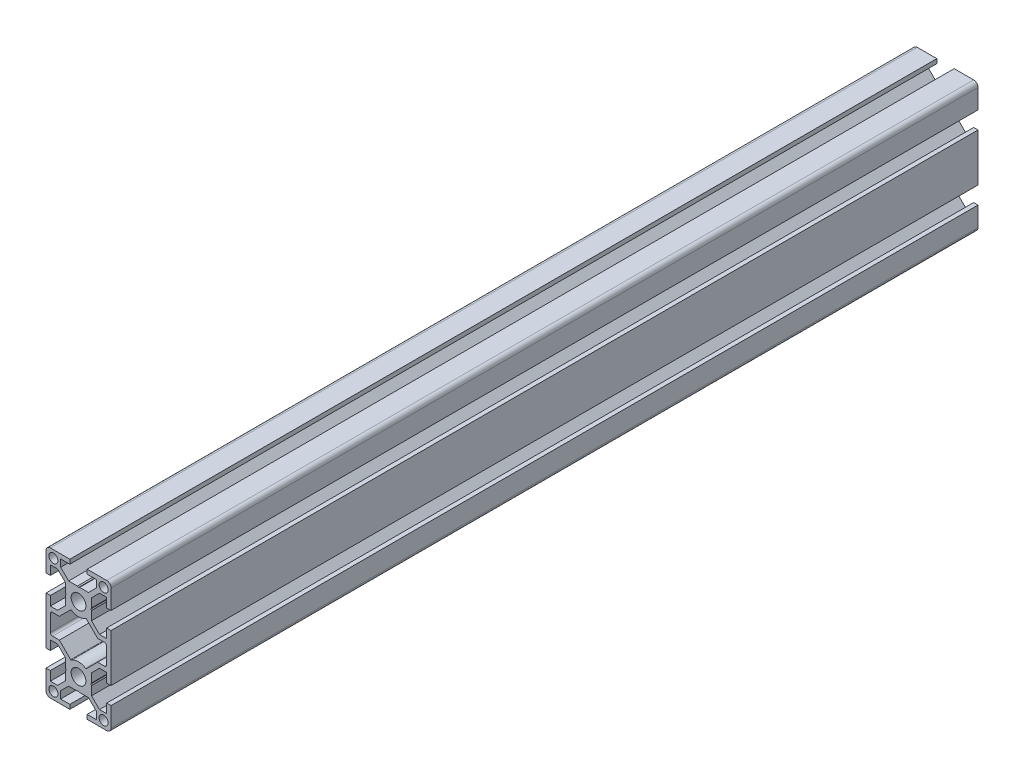
from build123d import *

# Parameters (mm, degrees)
MODEL_R             = 2.1
MODEL_R_2           = 3.4
BOSS_EXTRUDE1_DEPTH = 400


with BuildPart() as part:
    # Model → Boss-Extrude1 (new body)
    with BuildSketch(Plane.XY):
        with BuildLine():
            Line((13, -11), (15, -11))
            Line((15, -11), (15, 11))
            Line((15, 11), (13, 11))
            Line((13, 11), (13, 6.75))
            Line((13, 6.75), (9.664213562, 6.75))
            Line((9.664213562, 6.75), (6, 10.414213562))
            Line((6, 10.414213562), (6, 14.480384758))
            Line((6, 14.480384758), (5.7, 15))
            Line((5.7, 15), (6, 15.519615242))
            Line((6, 15.519615242), (6, 19.585786438))
            Line((6, 19.585786438), (9.664213562, 23.25))
            Line((9.664213562, 23.25), (13, 23.25))
            Line((13, 23.25), (13, 19))
            Line((13, 19), (15, 19))
            Line((15, 19), (15, 28))
            ThreePointArc((15, 28), (14.414213562, 29.414213562), (13, 30))
            Line((13, 30), (4, 30))
            Line((4, 30), (4, 28))
            Line((4, 28), (8.25, 28))
            Line((8.25, 28), (8.25, 24.664213562))
            Line((8.25, 24.664213562), (4.585786438, 21))
            Line((4.585786438, 21), (0.519615242, 21))
            Line((0.519615242, 21), (0, 20.7))
            Line((0, 20.7), (-0.519615242, 21))
            Line((-0.519615242, 21), (-4.585786438, 21))
            Line((-4.585786438, 21), (-8.25, 24.664213562))
            Line((-8.25, 24.664213562), (-8.25, 28))
            Line((-8.25, 28), (-4, 28))
            Line((-4, 28), (-4, 30))
            Line((-4, 30), (-13, 30))
            ThreePointArc((-13, 30), (-14.414213562, 29.414213562), (-15, 28))
            Line((-15, 28), (-15, 19))
            Line((-15, 19), (-13, 19))
            Line((-13, 19), (-13, 23.25))
            Line((-13, 23.25), (-9.664213562, 23.25))
            Line((-9.664213562, 23.25), (-6, 19.585786438))
            Line((-6, 19.585786438), (-6, 15.519615242))
            Line((-6, 15.519615242), (-5.7, 15))
            Line((-5.7, 15), (-6, 14.480384758))
            Line((-6, 14.480384758), (-6, 10.414213562))
            Line((-6, 10.414213562), (-9.664213562, 6.75))
            Line((-9.664213562, 6.75), (-13, 6.75))
            Line((-13, 6.75), (-13, 11))
            Line((-13, 11), (-15, 11))
            Line((-15, 11), (-15, -11))
            Line((-15, -11), (-13, -11))
            Line((-13, -11), (-13, -6.75))
            Line((-13, -6.75), (-9.664213562, -6.75))
            Line((-9.664213562, -6.75), (-6, -10.414213562))
            Line((-6, -10.414213562), (-6, -14.480384758))
            Line((-6, -14.480384758), (-5.7, -15))
            Line((-5.7, -15), (-6, -15.519615242))
            Line((-6, -15.519615242), (-6, -19.585786438))
            Line((-6, -19.585786438), (-9.664213562, -23.25))
            Line((-9.664213562, -23.25), (-13, -23.25))
            Line((-13, -23.25), (-13, -19))
            Line((-13, -19), (-15, -19))
            Line((-15, -19), (-15, -28))
            ThreePointArc((-15, -28), (-14.414213562, -29.414213562), (-13, -30))
            Line((-13, -30), (-4, -30))
            Line((-4, -30), (-4, -28))
            Line((-4, -28), (-8.25, -28))
            Line((-8.25, -28), (-8.25, -24.664213562))
            Line((-8.25, -24.664213562), (-4.585786438, -21))
            Line((-4.585786438, -21), (-0.519615242, -21))
            Line((-0.519615242, -21), (0, -20.7))
            Line((0, -20.7), (0.519615242, -21))
            Line((0.519615242, -21), (4.585786438, -21))
            Line((4.585786438, -21), (8.25, -24.664213562))
            Line((8.25, -24.664213562), (8.25, -28))
            Line((8.25, -28), (4, -28))
            Line((4, -28), (4, -30))
            Line((4, -30), (13, -30))
            ThreePointArc((13, -30), (14.414213562, -29.414213562), (15, -28))
            Line((15, -28), (15, -19))
            Line((15, -19), (13, -19))
            Line((13, -19), (13, -23.25))
            Line((13, -23.25), (9.664213562, -23.25))
            Line((9.664213562, -23.25), (6, -19.585786438))
            Line((6, -19.585786438), (6, -15.519615242))
            Line((6, -15.519615242), (5.7, -15))
            Line((5.7, -15), (6, -14.480384758))
            Line((6, -14.480384758), (6, -10.414213562))
            Line((6, -10.414213562), (9.664213562, -6.75))
            Line((9.664213562, -6.75), (13, -6.75))
            Line((13, -6.75), (13, -11))
        make_face()
        with Locations((11.6, -26.6)):
            Circle(MODEL_R, mode=Mode.SUBTRACT)
        with Locations((11.6, 26.6)):
            Circle(MODEL_R, mode=Mode.SUBTRACT)
        with Locations((0, 15)):
            Circle(MODEL_R_2, mode=Mode.SUBTRACT)
        with Locations((0, -15)):
            Circle(MODEL_R_2, mode=Mode.SUBTRACT)
        with Locations((-11.6, 26.6)):
            Circle(MODEL_R, mode=Mode.SUBTRACT)
        with Locations((-11.6, -26.6)):
            Circle(MODEL_R, mode=Mode.SUBTRACT)
        with BuildLine():
            Line((-8.835786438, 4.75), (-12, 4.75))
            ThreePointArc((-12, 4.75), (-12.707106781, 4.457106781), (-13, 3.75))
            Line((-13, 3.75), (-13, -3.75))
            ThreePointArc((-13, -3.75), (-12.707106781, -4.457106781), (-12, -4.75))
            Line((-12, -4.75), (-8.835786438, -4.75))
            Line((-8.835786438, -4.75), (-3.651792162, -9.933994275))
            ThreePointArc((-3.651792162, -9.933994275), (-3.470780421, -10.020243754), (-3.275866822, -9.973202156))
            ThreePointArc((-3.275866822, -9.973202156), (-2e-08, -9), (3.275866789, -9.973202134))
            ThreePointArc((3.275866789, -9.973202134), (3.470780401, -10.020243756), (3.651792162, -9.933994275))
            Line((3.651792162, -9.933994275), (8.835786438, -4.75))
            Line((8.835786438, -4.75), (12, -4.75))
            ThreePointArc((12, -4.75), (12.707106781, -4.457106781), (13, -3.75))
            Line((13, -3.75), (13, 3.75))
            ThreePointArc((13, 3.75), (12.707106781, 4.457106781), (12, 4.75))
            Line((12, 4.75), (8.835786438, 4.75))
            Line((8.835786438, 4.75), (3.651792162, 9.933994275))
            ThreePointArc((3.651792162, 9.933994275), (3.470780421, 10.020243754), (3.275866822, 9.973202156))
            ThreePointArc((3.275866822, 9.973202156), (2e-08, 9), (-3.275866789, 9.973202134))
            ThreePointArc((-3.275866789, 9.973202134), (-3.470780401, 10.020243756), (-3.651792162, 9.933994275))
            Line((-3.651792162, 9.933994275), (-8.835786438, 4.75))
        make_face(mode=Mode.SUBTRACT)
    extrude(amount=BOSS_EXTRUDE1_DEPTH)


solid = part.part
